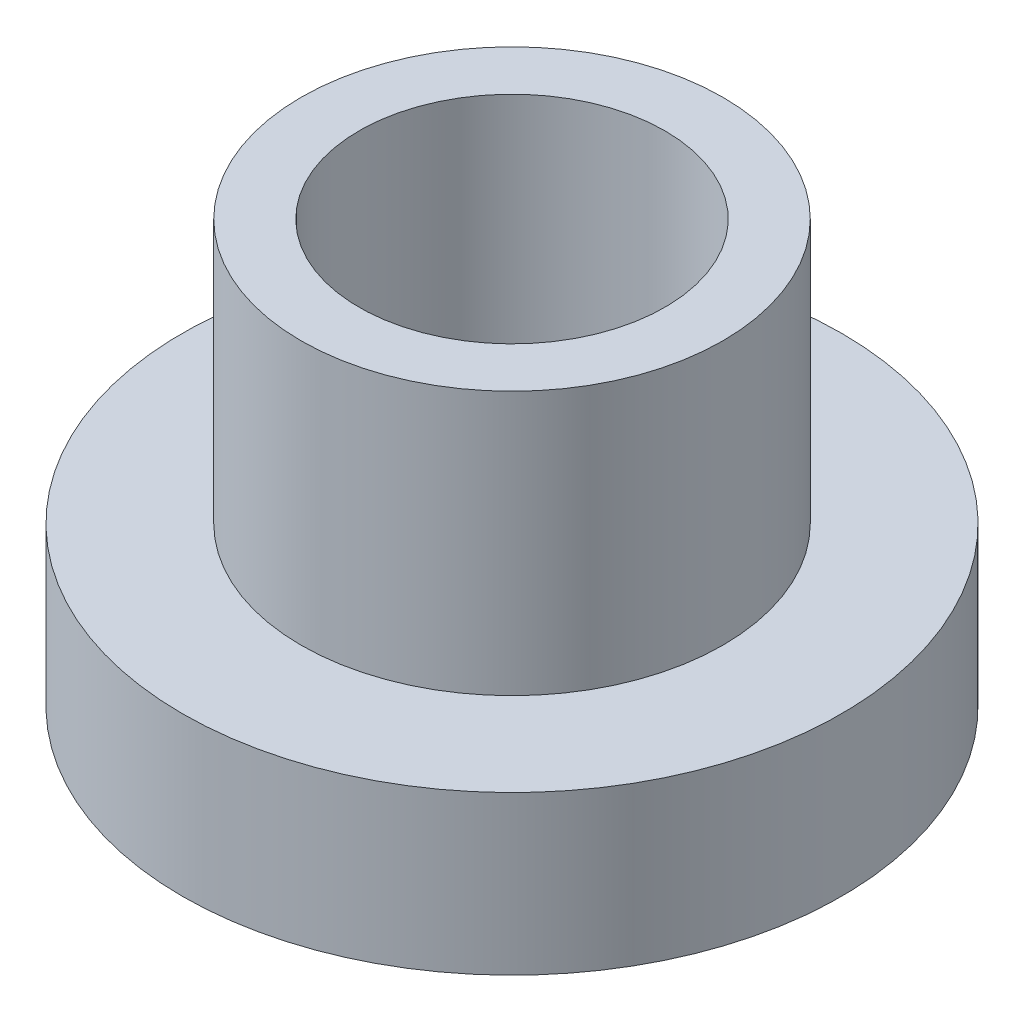
from build123d import *

# Parameters (mm, degrees)
SKETCH1_R                                            = 4
BOSS_EXTRUDE1_DEPTH                                  = 5
SKETCH2_R                                            = 6.25
BOSS_EXTRUDE2_DEPTH                                  = 3
SKETCH3_R                                            = 2.8
CUT_EXTRUDE1_DEPTH                                   = 12.921619018
CSK_FOR_M5_HEX_SOCKET_COUNTERSUNK_HEAD_S_D           = 5.8
CSK_FOR_M5_HEX_SOCKET_COUNTERSUNK_HEAD_S_CSINK_D     = 11.47
CSK_FOR_M5_HEX_SOCKET_COUNTERSUNK_HEAD_S_CSINK_ANGLE = 90


with BuildPart() as part:
    # Sketch1 → Boss-Extrude1 (new body)
    with BuildSketch(Plane(origin=(0, 0, 0), x_dir=(1, 0, 0), z_dir=(0, 1, 0))):
        with Locations(Location((0, 0, 0), (0, 0, 270))):
            Circle(SKETCH1_R)
    extrude(amount=BOSS_EXTRUDE1_DEPTH)

    # Sketch2 → Boss-Extrude2 (add)
    with BuildSketch(Plane.XZ):
        with Locations(Location((0, 0, 0), (0, 0, 270))):
            Circle(SKETCH2_R)
    extrude(amount=BOSS_EXTRUDE2_DEPTH)

    # Sketch3 → Cut-Extrude1 (cut, through all)
    with BuildSketch(Plane(origin=(0, 5, 0), x_dir=(1, 0, 0), z_dir=(0, 1, 0))):
        with Locations(Location((0, 0, 0), (0, 0, 270))):
            Circle(SKETCH3_R)
    extrude(amount=-CUT_EXTRUDE1_DEPTH, mode=Mode.SUBTRACT)

    # CSK for M5 Hex Socket Countersunk Head Screw1 (through all)
    with Locations(Plane(origin=(0, -3, 0), x_dir=(-1, 0, 0), z_dir=(0, -1, 0))):
        with Locations((0, 0)):
            CounterSinkHole(CSK_FOR_M5_HEX_SOCKET_COUNTERSUNK_HEAD_S_D / 2, CSK_FOR_M5_HEX_SOCKET_COUNTERSUNK_HEAD_S_CSINK_D / 2, counter_sink_angle=CSK_FOR_M5_HEX_SOCKET_COUNTERSUNK_HEAD_S_CSINK_ANGLE)


solid = part.part
